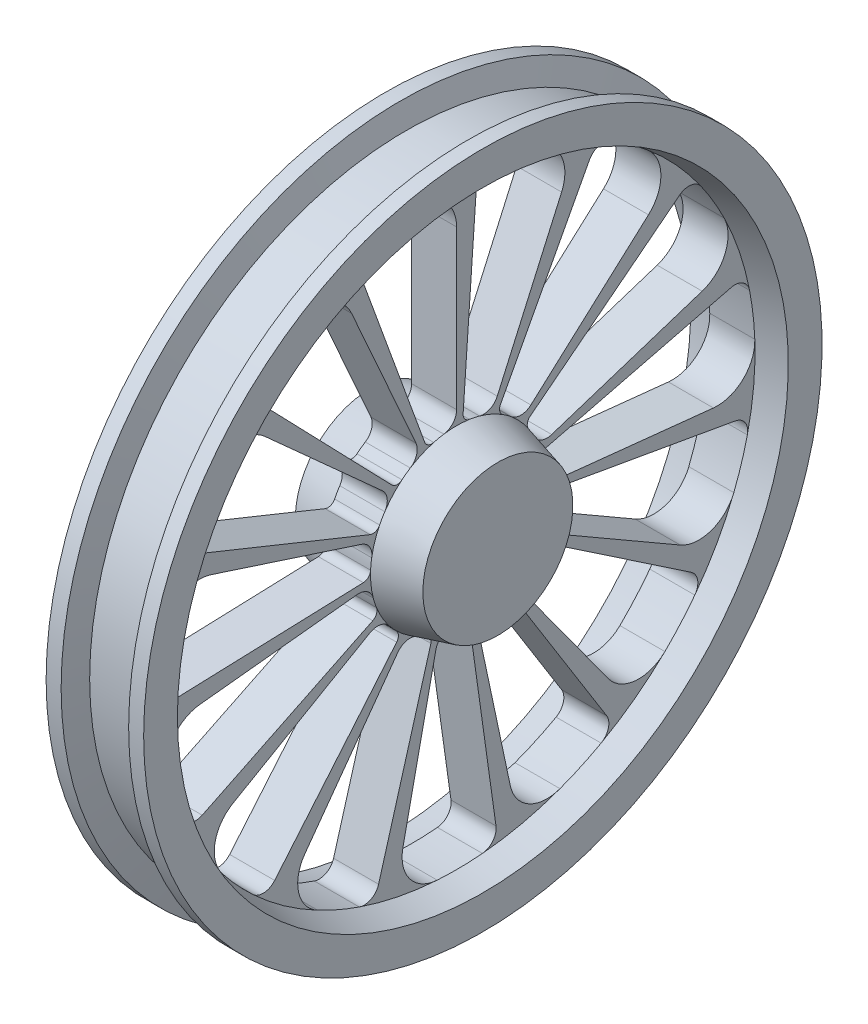
from build123d import *

# Parameters (mm, degrees)
CUT_EXTRUDE1_DEPTH = 662.636604922


with BuildPart() as part:
    # Sketch1 → Revolve1 (revolve)
    with BuildSketch(Plane(origin=(0, 0, 0), x_dir=(1, 0, 0), z_dir=(0, 1, 0)), mode=Mode.PRIVATE) as revolve1_sk:
        Polygon((-85, 0), (85, 0), (85, 100), (30, 114.737205584), (30, 397.762794416), (65, 407.141016151), (65, 452.141016151), (45, 452.141016151), (36.961524227, 422.141016151), (-36.961524227, 422.141016151), (-45, 452.141016151), (-65, 452.141016151), (-65, 407.141016151), (-30, 397.762794416), (-30, 114.737205584), (-85, 100), align=None)
    revolve(revolve1_sk.sketch.rotate(Axis((-565.784560179, 0, 0), (1, 0, 0)), 180), axis=Axis((-565.784560179, 0, 0), (1, 0, 0)))

    # Sketch2 → Cut-Extrude1 (cut, through all)
    with BuildSketch(Plane.ZY.offset(85)):
        with BuildLine():
            Line((0, 133.24456675), (0, 344.14962034))
            ThreePointArc((0, 344.14962034), (17.28486899, 381.961261444), (57.188808119, 393.630132037))
            ThreePointArc((57.188808119, 393.630132037), (86.876208966, 388.159458132), (116.063230163, 380.453107789))
            ThreePointArc((116.063230163, 380.453107789), (128.12340173, 370.252858523), (129.021281353, 354.483057146))
            Line((129.021281353, 354.483057146), (42.525319659, 116.837355519))
            ThreePointArc((42.525319659, 116.837355519), (37.714753572, 111.371314729), (30.472538424, 110.616683855))
            ThreePointArc((30.472538424, 110.616683855), (23.794589812, 112.242789705), (17.031258009, 113.46612973))
            ThreePointArc((17.031258009, 113.46612973), (4.844558076, 120.194180546), (0, 133.24456675))
        make_face()
        with BuildLine():
            Line((54.195447788, 121.72496871), (139.978261293, 314.396322411))
            ThreePointArc((139.978261293, 314.396322411), (171.148154816, 341.908585799), (212.348374404, 336.338235278))
            ThreePointArc((212.348374404, 336.338235278), (237.244041057, 319.26557222), (260.773256624, 300.354039845))
            ThreePointArc((260.773256624, 300.354039845), (267.641956434, 286.130334764), (262.04805421, 271.358703804))
            Line((262.04805421, 271.358703804), (86.370846379, 89.439629654))
            ThreePointArc((86.370846379, 89.439629654), (79.7529365, 86.40278642), (72.82990772, 88.659071091))
            ThreePointArc((72.82990772, 88.659071091), (67.390694934, 92.860759105), (61.709661101, 96.729230701))
            ThreePointArc((61.709661101, 96.729230701), (53.313101537, 107.832388384), (54.195447788, 121.72496871))
        make_face()
        with BuildLine():
            Line((99.020010304, 89.158017744), (255.753009546, 230.281044136))
            ThreePointArc((255.753009546, 230.281044136), (295.418369843, 242.736809527), (330.790977629, 220.890402102))
            ThreePointArc((330.790977629, 220.890402102), (346.590223154, 195.167768434), (360.393217965, 168.321029782))
            ThreePointArc((360.393217965, 168.321029782), (360.882785419, 152.533276711), (349.764337862, 141.313965358))
            Line((349.764337862, 141.313965358), (115.282069106, 46.576979287))
            ThreePointArc((115.282069106, 46.576979287), (108.001112174, 46.494431395), (102.594324332, 51.371499492))
            ThreePointArc((102.594324332, 51.371499492), (99.334336676, 57.422259641), (95.717903174, 63.266968927))
            ThreePointArc((95.717903174, 63.266968927), (92.563325408, 76.825396644), (99.020010304, 89.158017744))
        make_face()
        with BuildLine():
            Line((126.723113469, 41.174835534), (327.305739005, 106.348081293))
            ThreePointArc((327.305739005, 106.348081293), (368.608064932, 101.593633693), (392.036815681, 67.248611677))
            ThreePointArc((392.036815681, 67.248611677), (396.007806996, 37.323684443), (397.697917849, 7.183784521))
            ThreePointArc((397.697917849, 7.183784521), (391.723702287, -7.438170606), (377.003189989, -13.165241495))
            Line((377.003189989, -13.165241495), (124.259974779, -4.339253936))
            ThreePointArc((124.259974779, -4.339253936), (117.574914394, -1.453233208), (114.619250226, 5.201328936))
            ThreePointArc((114.619250226, 5.201328936), (114.102169183, 12.054929821), (113.175650218, 18.865273462))
            ThreePointArc((113.175650218, 18.865273462), (115.808509405, 32.534595887), (126.723113469, 41.174835534))
        make_face()
        with BuildLine():
            Line((132.514639072, -13.927849801), (342.264332711, -35.973430948))
            ThreePointArc((342.264332711, -35.973430948), (378.062076895, -57.116004355), (385.495926759, -98.021074642))
            ThreePointArc((385.495926759, -98.021074642), (376.952043389, -126.974003664), (366.237034766, -155.195602347))
            ThreePointArc((366.237034766, -155.195602347), (354.832032333, -166.123490652), (339.0547656, -165.368058492))
            Line((339.0547656, -165.368058492), (111.752201947, -54.505190733))
            ThreePointArc((111.752201947, -54.505190733), (106.818945781, -49.149620586), (106.825466474, -41.868198646))
            ThreePointArc((106.825466474, -41.868198646), (109.140700052, -35.39680688), (111.064299172, -28.798399169))
            ThreePointArc((111.064299172, -28.798399169), (119.029350038, -17.381732066), (132.514639072, -13.927849801))
        make_face()
        with BuildLine():
            Line((115.393179722, -66.622283375), (298.042313917, -172.07481017))
            ThreePointArc((298.042313917, -172.07481017), (322.145721177, -205.949766368), (312.29928998, -246.342026662))
            ThreePointArc((312.29928998, -246.342026662), (292.717846979, -269.316733015), (271.450441212, -290.740259661))
            ThreePointArc((271.450441212, -290.740259661), (256.58668044, -296.08454998), (242.480692023, -288.977235853))
            Line((242.480692023, -288.977235853), (79.921458161, -95.246684889))
            ThreePointArc((79.921458161, -95.246684889), (77.593011023, -88.347592055), (80.560589089, -81.698334321))
            ThreePointArc((80.560589089, -81.698334321), (85.30781237, -76.728114103), (89.74892181, -71.482566959))
            ThreePointArc((89.74892181, -71.482566959), (101.668934702, -64.292600637), (115.393179722, -66.622283375))
        make_face()
        with BuildLine():
            Line((78.319191284, -107.797118909), (202.286071418, -278.422891463))
            ThreePointArc((202.286071418, -278.422891463), (210.527443666, -319.172942781), (185.103268813, -352.068204325))
            ThreePointArc((185.103268813, -352.068204325), (157.870075568, -365.092152561), (129.727600323, -376.013284787))
            ThreePointArc((129.727600323, -376.013284787), (113.975160482, -374.849900772), (103.979503927, -362.61962386))
            Line((103.979503927, -362.61962386), (34.271568195, -119.519161938))
            ThreePointArc((34.271568195, -119.519161938), (34.950539748, -112.269462245), (40.366053981, -107.402085786))
            ThreePointArc((40.366053981, -107.402085786), (46.724428933, -104.792433344), (52.915140525, -101.806749523))
            ThreePointArc((52.915140525, -101.806749523), (66.729036923, -100.086694478), (78.319191284, -107.797118909))
        make_face()
        with BuildLine():
            Line((27.703103165, -130.332853278), (71.552729459, -336.629125429))
            ThreePointArc((71.552729459, -336.629125429), (62.507058562, -377.208217792), (25.901210858, -396.918591021))
            ThreePointArc((25.901210858, -396.918591021), (-4.274866113, -397.739822172), (-34.4263212, -396.270197))
            ThreePointArc((-34.4263212, -396.270197), (-48.343700155, -388.800298317), (-52.500685021, -373.561784605))
            Line((-52.500685021, -373.561784605), (-17.304187259, -123.12569009))
            ThreePointArc((-17.304187259, -123.12569009), (-13.735197365, -116.778922477), (-6.808138575, -114.535040901))
            ThreePointArc((-6.808138575, -114.535040901), (0.061967254, -114.73718885), (6.931850724, -114.527620209))
            ThreePointArc((6.931850724, -114.527620209), (20.251082445, -118.574889584), (27.703103165, -130.332853278))
        make_face()
        with BuildLine():
            Line((-27.703103165, -130.332853278), (-71.552729459, -336.629125429))
            ThreePointArc((-71.552729459, -336.629125429), (-96.321364825, -370.020765118), (-137.779401759, -373.138147437))
            ThreePointArc((-137.779401759, -373.138147437), (-165.680644608, -361.614663176), (-192.627619034, -348.00839215))
            ThreePointArc((-192.627619034, -348.00839215), (-202.303495846, -335.523592142), (-199.903028576, -319.91171909))
            Line((-199.903028576, -319.91171909), (-65.887891532, -105.442667864))
            ThreePointArc((-65.887891532, -105.442667864), (-60.045994073, -101.096246109), (-52.805142121, -101.863846927))
            ThreePointArc((-52.805142121, -101.863846927), (-46.611209125, -104.84284205), (-40.250019041, -107.44562491))
            ThreePointArc((-40.250019041, -107.44562491), (-29.728468162, -116.560409062), (-27.703103165, -130.332853278))
        make_face()
        with BuildLine():
            Line((-78.319191284, -107.797118909), (-202.286071418, -278.422891463))
            ThreePointArc((-202.286071418, -278.422891463), (-238.494949182, -298.853360621), (-277.636704126, -284.838728308))
            ThreePointArc((-277.636704126, -284.838728308), (-298.438734488, -262.963043751), (-317.521851571, -239.572774741))
            ThreePointArc((-317.521851571, -239.572774741), (-321.283179236, -224.231808751), (-312.740322428, -210.946011038))
            Line((-312.740322428, -210.946011038), (-103.078980787, -69.527650448))
            ThreePointArc((-103.078980787, -69.527650448), (-95.974292905, -67.933110359), (-89.671656875, -71.579468415))
            ThreePointArc((-89.671656875, -71.579468415), (-85.224883997, -76.820215392), (-80.472294854, -81.785304952))
            ThreePointArc((-80.472294854, -81.785304952), (-74.56769655, -94.391574896), (-78.319191284, -107.797118909))
        make_face()
        with BuildLine():
            Line((-115.393179722, -66.622283375), (-298.042313917, -172.07481017))
            ThreePointArc((-298.042313917, -172.07481017), (-339.430590167, -176.011495076), (-369.488098099, -147.288105375))
            ThreePointArc((-369.488098099, -147.288105375), (-379.594055945, -118.842725118), (-387.513671375, -89.712848128))
            ThreePointArc((-387.513671375, -89.712848128), (-384.71008217, -74.168308544), (-371.501973376, -65.505821293))
            Line((-371.501973376, -65.505821293), (-122.44677782, -21.590670631))
            ThreePointArc((-122.44677782, -21.590670631), (-115.307764594, -23.023722674), (-111.033127513, -28.918349534))
            ThreePointArc((-111.033127513, -28.918349534), (-109.102402183, -35.514675603), (-106.780179819, -41.983562771))
            ThreePointArc((-106.780179819, -41.983562771), (-106.513492778, -55.901579909), (-115.393179722, -66.622283375))
        make_face()
        with BuildLine():
            Line((-132.514639072, -13.927849801), (-342.264332711, -35.973430948))
            ThreePointArc((-342.264332711, -35.973430948), (-381.675598482, -22.735643018), (-397.451643217, 15.729969047))
            ThreePointArc((-397.451643217, 15.729969047), (-395.114116625, 45.826580341), (-390.500856947, 75.659244942))
            ThreePointArc((-390.500856947, 75.659244942), (-381.617116916, 88.719566008), (-366.027558137, 91.260920056))
            Line((-366.027558137, 91.260920056), (-120.642414575, 30.079532284))
            ThreePointArc((-120.642414575, 30.079532284), (-114.703476248, 25.866675825), (-113.1959617, 18.743014695))
            ThreePointArc((-113.1959617, 18.743014695), (-114.115123866, 11.931674239), (-114.624801626, 5.077518822))
            ThreePointArc((-114.624801626, 5.077518822), (-120.04213846, -7.745693906), (-132.514639072, -13.927849801))
        make_face()
        with BuildLine():
            Line((-126.723113469, 41.174835534), (-327.305739005, 106.348081293))
            ThreePointArc((-327.305739005, 106.348081293), (-357.925428405, 134.471408265), (-356.692188487, 176.028188918))
            ThreePointArc((-356.692188487, 176.028188918), (-342.315357041, 202.572053738), (-325.966896765, 227.949167218))
            ThreePointArc((-325.966896765, 227.949167218), (-312.539085264, 236.267021605), (-297.263652841, 232.247819247))
            Line((-297.263652841, 232.247819247), (-97.977881847, 76.548710803))
            ThreePointArc((-97.977881847, 76.548710803), (-94.265914809, 70.284491082), (-95.786185757, 63.163541409))
            ThreePointArc((-95.786185757, 63.163541409), (-99.39630393, 57.314929209), (-102.649753898, 51.260651282))
            ThreePointArc((-102.649753898, 51.260651282), (-112.814407853, 41.74949294), (-126.723113469, 41.174835534))
        make_face()
        with BuildLine():
            Line((-99.020010304, 89.158017744), (-255.753009546, 230.281044136))
            ThreePointArc((-255.753009546, 230.281044136), (-272.286700107, 268.427131424), (-254.257413922, 305.88953576))
            ThreePointArc((-254.257413922, 305.88953576), (-230.327162388, 324.290978734), (-205.070298815, 340.824607629))
            ThreePointArc((-205.070298815, 340.824607629), (-189.420206441, 342.961762748), (-177.100161412, 333.076960586))
            Line((-177.100161412, 333.076960586), (-58.372083247, 109.7819218))
            ThreePointArc((-58.372083247, 109.7819218), (-57.528920322, 102.549479317), (-61.814108105, 96.662517991))
            ThreePointArc((-61.814108105, 96.662517991), (-67.490960057, 92.787912228), (-72.925631177, 88.580351448))
            ThreePointArc((-72.925631177, 88.580351448), (-86.080041242, 84.025813175), (-99.020010304, 89.158017744))
        make_face()
        with BuildLine():
            Line((-54.195447788, 121.72496871), (-139.978261293, 314.396322411))
            ThreePointArc((-139.978261293, 314.396322411), (-139.567127713, 355.969364977), (-107.859222633, 382.85980295))
            ThreePointArc((-107.859222633, 382.85980295), (-78.513308901, 389.937047416), (-48.715183195, 394.768377087))
            ThreePointArc((-48.715183195, 394.768377087), (-33.548853096, 390.355299403), (-26.314443172, 376.314069529))
            Line((-26.314443172, 376.314069529), (-8.67322116, 124.032841181))
            ThreePointArc((-8.67322116, 124.032841181), (-10.844652876, 117.082730945), (-17.153809599, 113.44766706))
            ThreePointArc((-17.153809599, 113.44766706), (-23.915816055, 112.217022272), (-30.592004317, 110.583704121))
            ThreePointArc((-30.592004317, 110.583704121), (-44.461653488, 111.773306962), (-54.195447788, 121.72496871))
        make_face()
    extrude(amount=-CUT_EXTRUDE1_DEPTH, mode=Mode.SUBTRACT)


solid = part.part
